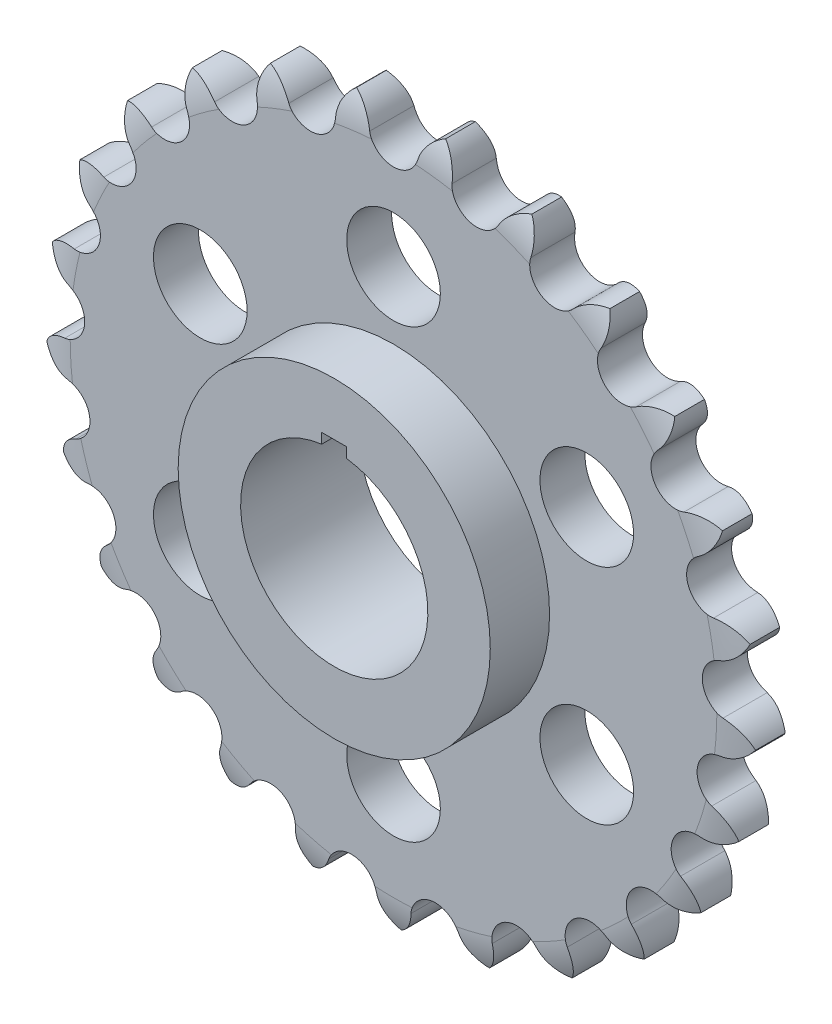
from build123d import *

# Parameters (mm, degrees)
CROQUIS1_R              = 15
SALIENTE_EXTRUIR1_DEPTH = 3.6
CROQUIS2_R              = 7.5
CORTAR_EXTRUIR1_DEPTH   = 7.2
CROQUIS3_R              = 25
CROQUIS3_R_2            = 7.50448531
SALIENTE_EXTRUIR2_DEPTH = 9.5
CROQUIS4_W              = 4
CROQUIS4_H              = 3
CORTAR_EXTRUIR2_DEPTH   = 83.587800757
CROQUIS6_R              = 15
CORTAR_EXTRUIR3_DEPTH   = 83.587800895
CROQUIS7_W              = 4
CROQUIS7_H              = 3
CORTAR_EXTRUIR4_DEPTH   = 83.587800895


with BuildPart() as part:
    # Croquis1 → Saliente-Extruir1 (new, symmetric)
    with BuildSketch(Plane.XY):
        with BuildLine():
            ThreePointArc((3.873354471, 52.576759485), (0, 49.575321021), (-3.873354471, 52.576759485))
            ThreePointArc((-3.873354471, 52.576759485), (-5.061490439, 54.879223964), (-7.129965337, 56.439487195))
            ThreePointArc((-7.129965337, 56.439487195), (-8.745433606, 54.413833714), (-9.323642466, 51.888227991))
            ThreePointArc((-9.323642466, 51.888227991), (-12.328880991, 48.017821149), (-16.826974302, 49.961699818))
            ThreePointArc((-16.826974302, 49.961699818), (-18.550382425, 51.896350741), (-20.941894067, 52.893186645))
            ThreePointArc((-20.941894067, 52.893186645), (-22.002849894, 50.529422171), (-21.934800657, 47.9393683))
            ThreePointArc((-21.934800657, 47.9393683), (-23.883093047, 43.443184976), (-28.723293452, 44.207362804))
            ThreePointArc((-28.723293452, 44.207362804), (-30.873685659, 45.65263894), (-33.437966574, 46.02341265))
            ThreePointArc((-33.437966574, 46.02341265), (-33.877746202, 43.470061199), (-33.167714652, 40.97830179))
            ThreePointArc((-33.167714652, 40.97830179), (-33.93664253, 36.138853719), (-38.814822437, 35.675314603))
            ThreePointArc((-38.814822437, 35.675314603), (-41.257081678, 36.540403935), (-43.833008665, 36.261818376))
            ThreePointArc((-43.833008665, 36.261818376), (-43.623979123, 33.67931641), (-42.316579154, 31.442417871))
            ThreePointArc((-42.316579154, 31.442417871), (-41.857827954, 26.563785373), (-46.467473378, 24.90165518))
            ThreePointArc((-46.467473378, 24.90165518), (-49.048143523, 25.132200965), (-51.473861615, 24.221760692))
            ThreePointArc((-51.473861615, 24.221760692), (-50.629156998, 21.772376307), (-48.806537357, 19.9308912))
            ThreePointArc((-48.806537357, 19.9308912), (-47.148932104, 15.319616697), (-51.200402071, 12.56333318))
            ThreePointArc((-51.200402071, 12.56333318), (-53.757330123, 12.144849379), (-55.880422532, 10.659760702))
            ThreePointArc((-55.880422532, 10.659760702), (-54.453118737, 8.497397728), (-52.229801321, 7.167033334))
            ThreePointArc((-52.229801321, 7.167033334), (-49.477495449, 3.112860163), (-52.7162212, -0.564389248))
            ThreePointArc((-52.7162212, -0.564389248), (-55.088745966, -1.60560776), (-56.775810987, -3.572031256))
            ThreePointArc((-56.775810987, -3.572031256), (-54.855590762, -5.311503602), (-52.37127478, -6.047155594))
            ThreePointArc((-52.37127478, -6.047155594), (-48.69720579, -9.289488824), (-50.919686274, -13.656649024))
            ThreePointArc((-50.919686274, -13.656649024), (-52.958733298, -15.255178658), (-54.103766432, -17.579379354))
            ThreePointArc((-54.103766432, -17.579379354), (-51.811284275, -18.786663626), (-49.222068436, -18.881379497))
            ThreePointArc((-49.222068436, -18.881379497), (-44.857091595, -21.108145063), (-45.923680191, -25.890811316))
            ThreePointArc((-45.923680191, -25.890811316), (-47.501128648, -27.946210576), (-48.032183251, -30.482150395))
            ThreePointArc((-48.032183251, -30.482150395), (-45.511484247, -31.081388482), (-42.980058506, -30.529216885))
            ThreePointArc((-42.980058506, -30.529216885), (-38.198441362, -31.600498918), (-38.042120385, -36.498158713))
            ThreePointArc((-38.042120385, -36.498158713), (-39.058853388, -38.881279305), (-38.942561347, -41.46961582))
            ThreePointArc((-38.942561347, -41.46961582), (-36.352030286, -41.42315539), (-34.037453431, -40.258791298))
            ThreePointArc((-34.037453431, -40.258791298), (-29.139642574, -40.107277208), (-27.770234246, -44.812192568))
            ThreePointArc((-27.770234246, -44.812192568), (-28.162366721, -47.37329426), (-27.406035093, -49.851392769))
            ThreePointArc((-27.406035093, -49.851392769), (-24.908444567, -49.162153102), (-22.956149976, -47.458757792))
            ThreePointArc((-22.956149976, -47.458757792), (-18.249892875, -46.093967766), (-15.753442158, -50.310511556))
            ThreePointArc((-15.753442158, -50.310511556), (-15.49633498, -52.888670909), (-14.147486862, -55.10082337))
            ThreePointArc((-14.147486862, -55.10082337), (-11.89976967, -53.812111928), (-10.432427191, -51.676715992))
            ThreePointArc((-10.432427191, -51.676715992), (-6.213435289, -49.184404807), (-2.746803362, -52.647636074))
            ThreePointArc((-2.746803362, -52.647636074), (-1.85661152, -55.080857855), (0, -56.888066592))
            ThreePointArc((0, -56.888066592), (1.85661152, -55.080857855), (2.746803362, -52.647636074))
            ThreePointArc((2.746803362, -52.647636074), (6.213435289, -49.184404807), (10.432427191, -51.676715992))
            ThreePointArc((10.432427191, -51.676715992), (11.89976967, -53.812111928), (14.147486862, -55.10082337))
            ThreePointArc((14.147486862, -55.10082337), (15.49633498, -52.888670909), (15.753442158, -50.310511556))
            ThreePointArc((15.753442158, -50.310511556), (18.249892875, -46.093967766), (22.956149976, -47.458757792))
            ThreePointArc((22.956149976, -47.458757792), (24.908444567, -49.162153102), (27.406035093, -49.851392769))
            ThreePointArc((27.406035093, -49.851392769), (28.162366721, -47.37329426), (27.770234246, -44.812192568))
            ThreePointArc((27.770234246, -44.812192568), (29.139642574, -40.107277208), (34.037453431, -40.258791298))
            ThreePointArc((34.037453431, -40.258791298), (36.352030286, -41.42315539), (38.942561347, -41.46961582))
            ThreePointArc((38.942561347, -41.46961582), (39.058853388, -38.881279305), (38.042120385, -36.498158713))
            ThreePointArc((38.042120385, -36.498158713), (38.198441362, -31.600498918), (42.980058506, -30.529216885))
            ThreePointArc((42.980058506, -30.529216885), (45.511484247, -31.081388482), (48.032183251, -30.482150395))
            ThreePointArc((48.032183251, -30.482150395), (47.501128648, -27.946210576), (45.923680191, -25.890811316))
            ThreePointArc((45.923680191, -25.890811316), (44.857091595, -21.108145063), (49.222068436, -18.881379497))
            ThreePointArc((49.222068436, -18.881379497), (51.811284275, -18.786663626), (54.103766432, -17.579379354))
            ThreePointArc((54.103766432, -17.579379354), (52.958733298, -15.255178658), (50.919686274, -13.656649024))
            ThreePointArc((50.919686274, -13.656649024), (48.69720579, -9.289488824), (52.37127478, -6.047155594))
            ThreePointArc((52.37127478, -6.047155594), (54.855590762, -5.311503602), (56.775810987, -3.572031256))
            ThreePointArc((56.775810987, -3.572031256), (55.088745966, -1.60560776), (52.7162212, -0.564389248))
            ThreePointArc((52.7162212, -0.564389248), (49.477495449, 3.112860163), (52.229801321, 7.167033334))
            ThreePointArc((52.229801321, 7.167033334), (54.453118737, 8.497397728), (55.880422532, 10.659760702))
            ThreePointArc((55.880422532, 10.659760702), (53.757330123, 12.144849379), (51.200402071, 12.56333318))
            ThreePointArc((51.200402071, 12.56333318), (47.148932104, 15.319616697), (48.806537357, 19.9308912))
            ThreePointArc((48.806537357, 19.9308912), (50.629156998, 21.772376307), (51.473861615, 24.221760692))
            ThreePointArc((51.473861615, 24.221760692), (49.048143523, 25.132200965), (46.467473378, 24.90165518))
            ThreePointArc((46.467473378, 24.90165518), (41.857827954, 26.563785373), (42.316579154, 31.442417871))
            ThreePointArc((42.316579154, 31.442417871), (43.623979123, 33.67931641), (43.833008665, 36.261818376))
            ThreePointArc((43.833008665, 36.261818376), (41.257081678, 36.540403935), (38.814822437, 35.675314603))
            ThreePointArc((38.814822437, 35.675314603), (33.93664253, 36.138853719), (33.167714652, 40.97830179))
            ThreePointArc((33.167714652, 40.97830179), (33.877746202, 43.470061199), (33.437966574, 46.02341265))
            ThreePointArc((33.437966574, 46.02341265), (30.873685659, 45.65263894), (28.723293452, 44.207362804))
            ThreePointArc((28.723293452, 44.207362804), (23.883093047, 43.443184976), (21.934800657, 47.9393683))
            ThreePointArc((21.934800657, 47.9393683), (22.002849894, 50.529422171), (20.941894067, 52.893186645))
            ThreePointArc((20.941894067, 52.893186645), (18.550382425, 51.896350741), (16.826974302, 49.961699818))
            ThreePointArc((16.826974302, 49.961699818), (12.328880991, 48.017821149), (9.323642466, 51.888227991))
            ThreePointArc((9.323642466, 51.888227991), (8.745433606, 54.413833714), (7.129965337, 56.439487195))
            ThreePointArc((7.129965337, 56.439487195), (5.061490439, 54.879223964), (3.873354471, 52.576759485))
        make_face()
        Circle(CROQUIS1_R, mode=Mode.SUBTRACT)
    extrude(amount=SALIENTE_EXTRUIR1_DEPTH, both=True)

    # Croquis2 → Cortar-Extruir1 (cut)
    with BuildSketch(Plane.XY.offset(3.6)):
        with Locations((0, 35.742736554)):
            Circle(CROQUIS2_R)
        with Locations((30.954117857, 17.871368277)):
            Circle(CROQUIS2_R)
        with Locations((30.954117857, -17.871368277)):
            Circle(CROQUIS2_R)
        with Locations((0, -35.742736554)):
            Circle(CROQUIS2_R)
        with Locations((-30.954117857, -17.871368277)):
            Circle(CROQUIS2_R)
        with Locations((-30.954117857, 17.871368277)):
            Circle(CROQUIS2_R)
    extrude(amount=-CORTAR_EXTRUIR1_DEPTH, mode=Mode.SUBTRACT)

    # Croquis3 → Saliente-Extruir2 (add, symmetric)
    with BuildSketch(Plane.XY.offset(3.6)):
        Circle(CROQUIS3_R)
        Circle(CROQUIS3_R_2, mode=Mode.SUBTRACT)
    extrude(amount=SALIENTE_EXTRUIR2_DEPTH, both=True)

    # Croquis4 → Cortar-Extruir2 (cut, through all)
    with BuildSketch(Plane.XY.offset(13.1)):
        with Locations((0, 7.50448531)):
            Rectangle(CROQUIS4_W, CROQUIS4_H)
    extrude(amount=-CORTAR_EXTRUIR2_DEPTH, mode=Mode.SUBTRACT)

    # Croquis5 → Cortar-Revolución1 (revolve, cut)
    with BuildSketch(Plane(origin=(0, 0, 0), x_dir=(0, 0, -1), z_dir=(1, 0, 0))):
        with BuildLine():
            Line((-2.1, 57.439487195), (-9.784873408, 57.439487195))
            Line((-9.784873408, 57.439487195), (-9.784873408, 51.089487195))
            Line((-9.784873408, 51.089487195), (-3.6, 51.089487195))
            ThreePointArc((-3.6, 51.089487195), (-3.26475648, 54.362461167), (-2.1, 57.439487195))
        make_face()
        with BuildLine():
            Line((9.784873408, 51.089487195), (3.6, 51.089487195))
            ThreePointArc((3.6, 51.089487195), (3.26475648, 54.362461167), (2.1, 57.439487195))
            Line((2.1, 57.439487195), (9.784873408, 57.439487195))
            Line((9.784873408, 57.439487195), (9.784873408, 51.089487195))
        make_face()
    revolve(axis=Axis((0, 0, 13.1), (0, 0, -1)), mode=Mode.SUBTRACT)

    # Croquis6 → Cortar-Extruir3 (cut, through all)
    with BuildSketch(Plane(origin=(0, 0, -5.9), x_dir=(-1, 0, 0), z_dir=(0, 0, -1))):
        Circle(CROQUIS6_R)
    extrude(amount=-CORTAR_EXTRUIR3_DEPTH, mode=Mode.SUBTRACT)

    # Croquis7 → Cortar-Extruir4 (cut, through all)
    with BuildSketch(Plane.XY.offset(13.1)):
        with Locations((0, 15)):
            Rectangle(CROQUIS7_W, CROQUIS7_H)
    extrude(amount=-CORTAR_EXTRUIR4_DEPTH, mode=Mode.SUBTRACT)


solid = part.part
